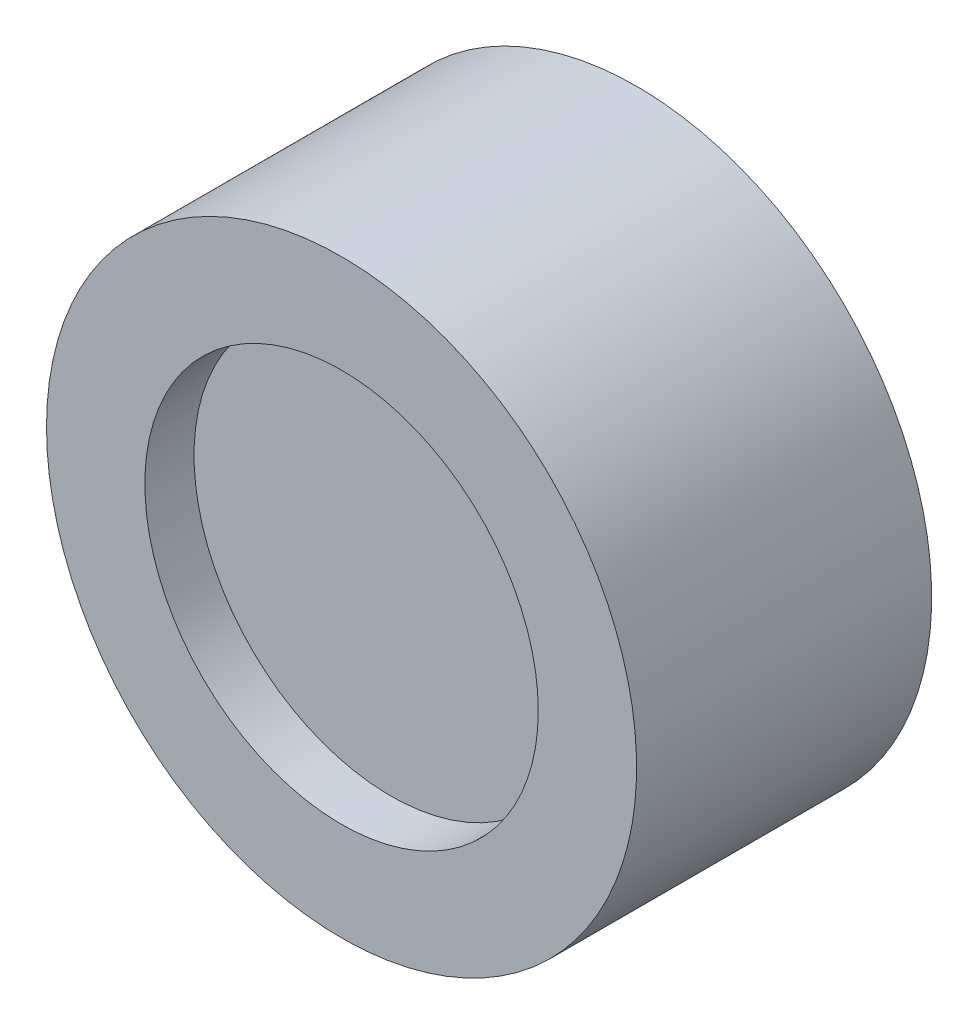
from build123d import *

# Parameters (mm, degrees)
SKETCH1_R           = 38.1
BOSS_EXTRUDE1_DEPTH = 38.1
SKETCH2_R           = 25.4
CUT_EXTRUDE1_DEPTH  = 6.35


with BuildPart() as part:
    # Sketch1 → Boss-Extrude1 (new body)
    with BuildSketch(Plane.XY):
        with Locations(Location((0, 0, 0), (0, 0, 180))):
            Circle(SKETCH1_R)
    extrude(amount=BOSS_EXTRUDE1_DEPTH)

    # Sketch2 → Cut-Extrude1 (cut)
    with BuildSketch(Plane.XY.offset(38.1)):
        Circle(SKETCH2_R)
    extrude(amount=-CUT_EXTRUDE1_DEPTH, mode=Mode.SUBTRACT)


solid = part.part
